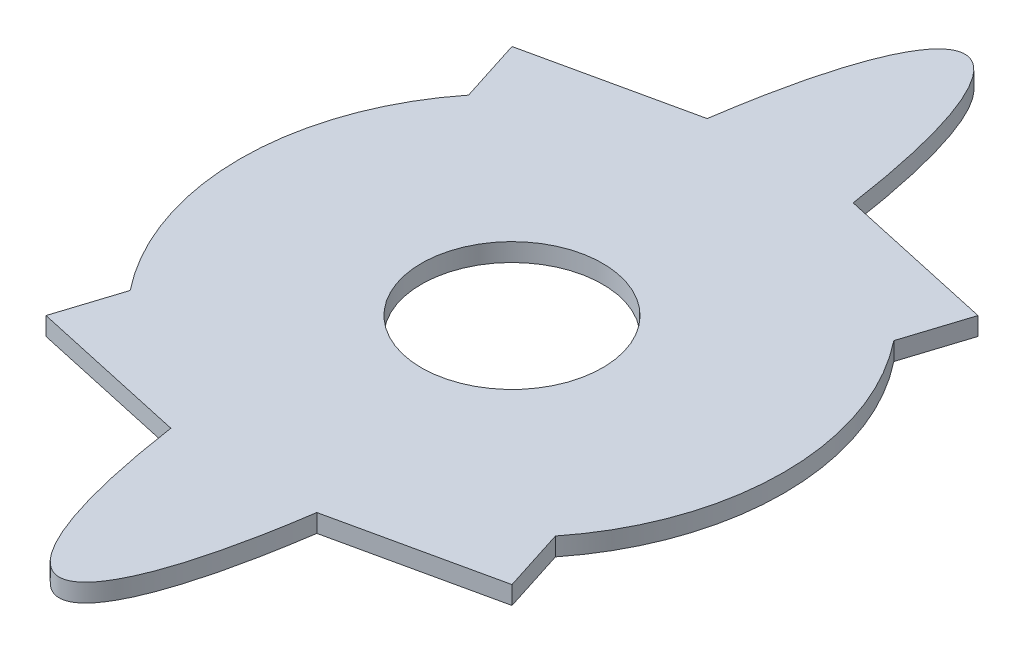
from build123d import *

# Parameters (mm, degrees)
SZKIC1_R                    = 10
DODANIE_WYCI_GNI_CIE1_DEPTH = 2


with BuildPart() as part:
    # Szkic1 → Dodanie-wyciągnięcie1 (new body)
    with BuildSketch(Plane(origin=(0, 0, 0), x_dir=(1, 0, 0), z_dir=(0, 1, 0))):
        with BuildLine():
            Line((25.724787771, -25.724787771), (23.475270357, -18.679177757))
            ThreePointArc((23.475270357, -18.679177757), (30, 0), (23.475270357, 18.679177757))
            Line((23.475270357, 18.679177757), (25.724787771, 25.724787771))
            Line((25.724787771, 25.724787771), (8.05822964, 29.607826273))
            add(Edge.make_bspline(
                [(8.05822964, 29.607826273), (7.79792239, 31.378992774), (7.507535684, 33.029118956)],
                knots=[5.346121376, 5.346121376, 5.346121376, 5.433983203, 5.433983203, 5.433983203], degree=2, weights=[1, 0.999035193, 1]))
            add(Edge.make_bspline(
                [(7.507535684, 33.029118956), (5.218865934, 46.034514162), (1.811566447, 49.17271271)],
                knots=[5.433983203, 5.433983203, 5.433983203, 6.101022879, 6.101022879, 6.101022879], degree=2, weights=[1, 0.944895907, 1]))
            add(Edge.make_bspline(
                [(1.811566447, 49.17271271), (0.913339162, 50), (0, 50)],
                knots=[6.101022879, 6.101022879, 6.101022879, 6.283185307, 6.283185307, 6.283185307], degree=2, weights=[1, 0.995854973, 1]))
            add(Edge.make_bspline(
                [(0, 50), (-0.913339162, 50), (-1.811566447, 49.17271271)],
                knots=[0, 0, 0, 0.182162428, 0.182162428, 0.182162428], degree=2, weights=[1, 0.995854973, 1]))
            add(Edge.make_bspline(
                [(-1.811566447, 49.17271271), (-5.218865934, 46.034514162), (-7.507535684, 33.029118956)],
                knots=[0.182162428, 0.182162428, 0.182162428, 0.849202104, 0.849202104, 0.849202104], degree=2, weights=[1, 0.944895907, 1]))
            add(Edge.make_bspline(
                [(-7.507535684, 33.029118956), (-7.79792239, 31.378992774), (-8.05822964, 29.607826273)],
                knots=[0.849202104, 0.849202104, 0.849202104, 0.937063931, 0.937063931, 0.937063931], degree=2, weights=[1, 0.999035193, 1]))
            Line((-8.05822964, 29.607826273), (-25.724787771, 25.724787771))
            Line((-25.724787771, 25.724787771), (-23.475270357, 18.679177757))
            ThreePointArc((-23.475270357, 18.679177757), (-30, 0), (-23.475270357, -18.679177757))
            Line((-23.475270357, -18.679177757), (-25.724787771, -25.724787771))
            Line((-25.724787771, -25.724787771), (-8.05822964, -29.607826273))
            add(Edge.make_bspline(
                [(-8.05822964, -29.607826273), (-7.79792239, -31.378992774), (-7.507535684, -33.029118956)],
                knots=[2.204528722, 2.204528722, 2.204528722, 2.292390549, 2.292390549, 2.292390549], degree=2, weights=[1, 0.999035193, 1]))
            add(Edge.make_bspline(
                [(-7.507535684, -33.029118956), (-5.218865934, -46.034514162), (-1.811566447, -49.17271271)],
                knots=[2.292390549, 2.292390549, 2.292390549, 2.959430225, 2.959430225, 2.959430225], degree=2, weights=[1, 0.944895907, 1]))
            add(Edge.make_bspline(
                [(-1.811566447, -49.17271271), (-0.913339162, -50), (0, -50)],
                knots=[2.959430225, 2.959430225, 2.959430225, 3.141592654, 3.141592654, 3.141592654], degree=2, weights=[1, 0.995854973, 1]))
            add(Edge.make_bspline(
                [(0, -50), (0.913339162, -50), (1.811566447, -49.17271271)],
                knots=[3.141592654, 3.141592654, 3.141592654, 3.323755082, 3.323755082, 3.323755082], degree=2, weights=[1, 0.995854973, 1]))
            add(Edge.make_bspline(
                [(1.811566447, -49.17271271), (5.218865934, -46.034514162), (7.507535684, -33.029118956)],
                knots=[3.323755082, 3.323755082, 3.323755082, 3.990794758, 3.990794758, 3.990794758], degree=2, weights=[1, 0.944895907, 1]))
            add(Edge.make_bspline(
                [(7.507535684, -33.029118956), (7.79792239, -31.378992774), (8.05822964, -29.607826273)],
                knots=[3.990794758, 3.990794758, 3.990794758, 4.078656585, 4.078656585, 4.078656585], degree=2, weights=[1, 0.999035193, 1]))
            Line((8.05822964, -29.607826273), (25.724787771, -25.724787771))
        make_face()
        with Locations(Location((0, 0, 0), (0, 0, 270))):
            Circle(SZKIC1_R, mode=Mode.SUBTRACT)
    extrude(amount=DODANIE_WYCI_GNI_CIE1_DEPTH)


solid = part.part
